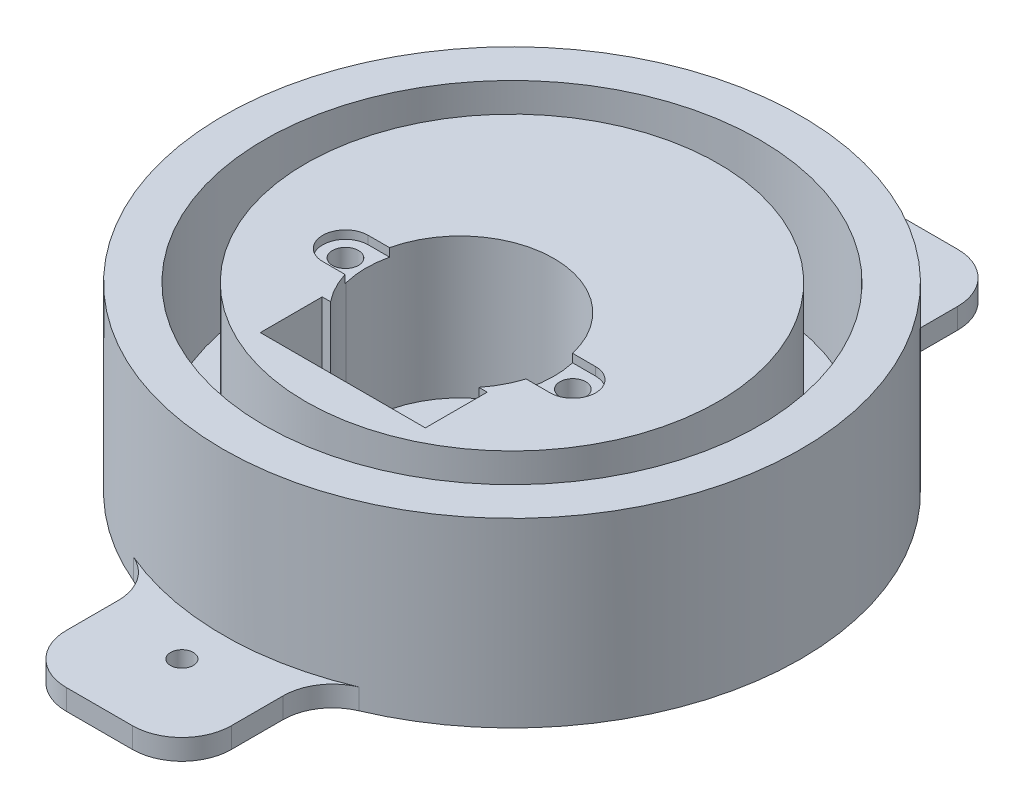
from build123d import *

# Parameters (mm, degrees)
SKETCH2_R           = 44.45
SKETCH2_R_2         = 38.1
BOSS_EXTRUDE1_DEPTH = 6.35
SKETCH2_3_R         = 44.45
SKETCH2_3_R_2       = 38.1
BOSS_EXTRUDE2_DEPTH = 27.94
SKETCH3_R           = 31.75
BOSS_EXTRUDE4_DEPTH = 21.59
CUT_EXTRUDE1_START  = -1.27
SKETCH4_R           = 2
CUT_EXTRUDE1_DEPTH  = 1.27
CUT_EXTRUDE2_START  = -8.89
SKETCH4_3_R         = 2
CUT_EXTRUDE2_DEPTH  = 8.89
SKETCH5_W           = 25.4
SKETCH5_H           = 25.4
BOSS_EXTRUDE6_DEPTH = 3.175
FILLET1_R           = 7.62
SKETCH7_R           = 1.75
CUT_EXTRUDE3_DEPTH  = 11.43
SKETCH8_W           = 25.4
SKETCH8_H           = 9.525
CUT_EXTRUDE4_DEPTH  = 21.59


with BuildPart() as part:
    # Sketch2 → Boss-Extrude1 (new body)
    # profile 1 of 2: a face of its own
    with BuildSketch(Plane(origin=(0, 0, 0), x_dir=(1, 0, 0), z_dir=(0, 1, 0))):
        with Locations(Location((0, 0, 0), (0, 0, 270))):
            Circle(SKETCH2_R)
        Circle(SKETCH2_R_2, mode=Mode.SUBTRACT)
    # profile 2 of 2: a face of its own
    with BuildSketch(Plane(origin=(0, 0, 0), x_dir=(1, 0, 0), z_dir=(0, 1, 0))):
        Circle(SKETCH2_R_2)
    extrude(amount=BOSS_EXTRUDE1_DEPTH)

    # Sketch2<3> → Boss-Extrude2 (add)
    with BuildSketch(Plane(origin=(0, 0, 0), x_dir=(1, 0, 0), z_dir=(0, 1, 0))):
        with Locations(Location((0, 0, 0), (0, 0, 270))):
            Circle(SKETCH2_3_R)
        with Locations(Location((0, 0, 0), (0, 0, 270))):
            Circle(SKETCH2_3_R_2, mode=Mode.SUBTRACT)
    extrude(amount=BOSS_EXTRUDE2_DEPTH)

    # Sketch3 → Boss-Extrude4 (add)
    # profile 1 of 3: a face of its own
    with BuildSketch(Plane(origin=(0, 6.35, 0), x_dir=(1, 0, 0), z_dir=(0, 1, 0))):
        with Locations(Location((0, 0, 0), (0, 0, 270))):
            Circle(SKETCH3_R)
        with BuildLine():
            ThreePointArc((17.528088934, -11.500057344), (21.028088934, -8.000057344), (17.528088934, -4.500057344))
            Line((17.528088934, -4.500057344), (14.019310816, -4.500057344))
            ThreePointArc((14.019310816, -4.500057344), (0, 6.449547348), (-14.019310816, -4.500057344))
            Line((-14.019310816, -4.500057344), (-17.471911066, -4.500057344))
            ThreePointArc((-17.471911066, -4.500057344), (-20.971911066, -8.000057344), (-17.471911066, -11.500057344))
            Line((-17.471911066, -11.500057344), (-14.019310816, -11.500057344))
            ThreePointArc((-14.019310816, -11.500057344), (0, -22.010555024), (14.019310816, -11.500057344))
            Line((14.019310816, -11.500057344), (17.528088934, -11.500057344))
        make_face(mode=Mode.SUBTRACT)
    # profile 2 of 3: a face of its own
    with BuildSketch(Plane(origin=(0, 6.35, 0), x_dir=(1, 0, 0), z_dir=(0, 1, 0))):
        with BuildLine():
            ThreePointArc((-14.019310816, -4.500057344), (-14.449604692, -8.000057344), (-14.019310816, -11.500057344))
            Line((-14.019310816, -11.500057344), (-17.471911066, -11.500057344))
            ThreePointArc((-17.471911066, -11.500057344), (-20.971911066, -8.000057344), (-17.471911066, -4.500057344))
            Line((-17.471911066, -4.500057344), (-14.019310816, -4.500057344))
        make_face()
    # profile 3 of 3: a face of its own
    with BuildSketch(Plane(origin=(0, 6.35, 0), x_dir=(1, 0, 0), z_dir=(0, 1, 0))):
        with BuildLine():
            Line((17.528088934, -4.500057344), (14.019310816, -4.500057344))
            ThreePointArc((14.019310816, -4.500057344), (14.449604692, -8.000057344), (14.019310816, -11.500057344))
            Line((14.019310816, -11.500057344), (17.528088934, -11.500057344))
            ThreePointArc((17.528088934, -11.500057344), (21.028088934, -8.000057344), (17.528088934, -4.500057344))
        make_face()
    extrude(amount=BOSS_EXTRUDE4_DEPTH)

    # Sketch4 → Cut-Extrude1 (cut)
    # profile 1 of 2: a face of its own
    with BuildSketch(Plane(origin=(0, 27.94, 0), x_dir=(1, 0, 0), z_dir=(0, 1, 0)).offset(CUT_EXTRUDE1_START)):
        with BuildLine():
            Line((17.631328518, -4.762679984), (14.082274801, -4.762679984))
            ThreePointArc((14.082274801, -4.762679984), (14.448973734, -8.135089853), (14.019310816, -11.500057344))
            ThreePointArc((14.019310816, -11.500057344), (13.980234208, -11.631555081), (13.939924214, -11.762679984))
            Line((13.939924214, -11.762679984), (17.631328518, -11.762679984))
            ThreePointArc((17.631328518, -11.762679984), (21.131328518, -8.262679984), (17.631328518, -4.762679984))
        make_face()
        with Locations(Location((17.631328518, -8.262679984, 0), (0, 0, 270))):
            Circle(SKETCH4_R, mode=Mode.SUBTRACT)
    # profile 2 of 2: a face of its own
    with BuildSketch(Plane(origin=(0, 27.94, 0), x_dir=(1, 0, 0), z_dir=(0, 1, 0)).offset(CUT_EXTRUDE1_START)):
        with BuildLine():
            ThreePointArc((-14.019310816, -11.500057344), (-14.448973734, -8.135089853), (-14.082274801, -4.762679984))
            Line((-14.082274801, -4.762679984), (-17.368671482, -4.762679984))
            ThreePointArc((-17.368671482, -4.762679984), (-20.868671482, -8.262679984), (-17.368671482, -11.762679984))
            Line((-17.368671482, -11.762679984), (-13.939924214, -11.762679984))
            ThreePointArc((-13.939924214, -11.762679984), (-13.980234208, -11.631555081), (-14.019310816, -11.500057344))
        make_face()
        with Locations(Location((-17.368671482, -8.262679984, 0), (0, 0, 270))):
            Circle(SKETCH4_R, mode=Mode.SUBTRACT)
    extrude(amount=CUT_EXTRUDE1_DEPTH, mode=Mode.SUBTRACT)

    # Sketch4<3> → Cut-Extrude2 (cut)
    with BuildSketch(Plane(origin=(0, 27.94, 0), x_dir=(1, 0, 0), z_dir=(0, 1, 0)).offset(CUT_EXTRUDE2_START)):
        with Locations(Location((-17.368671482, -8.262679984, 0), (0, 0, 270))):
            Circle(SKETCH4_3_R)
        with Locations(Location((17.631328518, -8.262679984, 0), (0, 0, 270))):
            Circle(SKETCH4_3_R)
    extrude(amount=CUT_EXTRUDE2_DEPTH, mode=Mode.SUBTRACT)

    # Sketch5 → Boss-Extrude6 (add)
    with BuildSketch(Plane.XZ):
        with Locations((0, 50.8)):
            Rectangle(SKETCH5_W, SKETCH5_H)
        with Locations((0, -50.8)):
            Rectangle(SKETCH5_W, SKETCH5_H)
    extrude(amount=-BOSS_EXTRUDE6_DEPTH)

    # Fillet1
    fillet1_edges = [part.edges().sort_by_distance(p)[0] for p in [
        (12.7, 1.5875, 63.5),
        (-12.7, 1.5875, 63.5),
        (12.7, 1.5875, 42.597094971),
        (-12.7, 1.5875, 42.597094971),
        (-12.7, 1.5875, -63.5),
        (12.7, 1.5875, -63.5),
        (-12.7, 1.5875, -42.597094971),
        (12.7, 1.5875, -42.597094971),
    ]]
    fillet(fillet1_edges, radius=FILLET1_R)

    # Sketch7 → Cut-Extrude3 (cut)
    with BuildSketch(Plane(origin=(0, 3.175, 0), x_dir=(1, 0, 0), z_dir=(0, 1, 0))):
        with Locations(Location((0, 50.8, 0), (0, 0, 270))):
            Circle(SKETCH7_R)
        with Locations(Location((0, -50.8, 0), (0, 0, 270))):
            Circle(SKETCH7_R)
    extrude(amount=-CUT_EXTRUDE3_DEPTH, mode=Mode.SUBTRACT)

    # Sketch8 → Cut-Extrude4 (cut)
    with BuildSketch(Plane(origin=(0, 27.94, 0), x_dir=(1, 0, 0), z_dir=(0, 1, 0))):
        with Locations((0, -21.2725)):
            Rectangle(SKETCH8_W, SKETCH8_H)
    extrude(amount=-CUT_EXTRUDE4_DEPTH, mode=Mode.SUBTRACT)


solid = part.part
